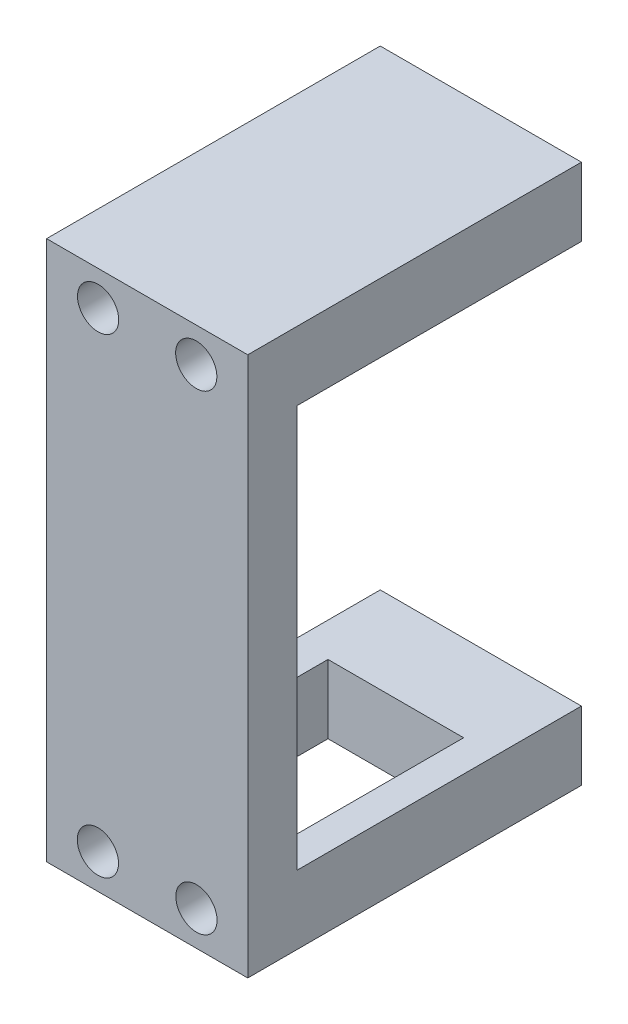
from build123d import *

# Parameters (mm, degrees)
BOSS_EXTRUDE1_DEPTH = 20.5
SKETCH3_W           = 13.820879987
SKETCH3_H           = 19.579579981
CUT_EXTRUDE1_DEPTH  = 7
SKETCH4_R           = 2.1
CUT_EXTRUDE2_DEPTH  = 5


with BuildPart() as part:
    # Sketch1 → Boss-Extrude1 (new body)
    with BuildSketch(Plane(origin=(0, 0, 0), x_dir=(0, 0, -1), z_dir=(1, 0, 0))):
        Polygon((-2.5, 27.5), (2.5, 27.5), (31.5, 27.5), (31.5, 20.5), (2.5, 20.5), (2.5, -20.5), (31.5, -20.5), (31.5, -27.5), (2.5, -27.5), (-2.5, -27.5), align=None)
    extrude(amount=BOSS_EXTRUDE1_DEPTH)

    # Sketch3 → Cut-Extrude1 (cut)
    with BuildSketch(Plane.XZ.offset(27.5)):
        with Locations((10.385498824, -12.910906187)):
            Rectangle(SKETCH3_W, SKETCH3_H)
    extrude(amount=-CUT_EXTRUDE1_DEPTH, mode=Mode.SUBTRACT)

    # Sketch4 → Cut-Extrude2 (cut)
    with BuildSketch(Plane(origin=(0, 0, -31.5), x_dir=(-1, 0, 0), z_dir=(0, 0, -1))):
        with Locations((-15.271378587, -23.970399076)):
            Circle(SKETCH4_R)
        with Locations(Location((-5.228621413, -23.970399076, 0), (0, 0, 180))):
            Circle(SKETCH4_R)
        with Locations((-5.25, 24)):
            Circle(SKETCH4_R)
        with Locations(Location((-15.25, 24, 0), (0, 0, 180))):
            Circle(SKETCH4_R)
    cut_extrude2 = extrude(amount=-CUT_EXTRUDE2_DEPTH, mode=Mode.SUBTRACT)

    # Mirror1: Cut-Extrude2 across plane
    add(cut_extrude2.mirror(Plane.XY.offset(-14.5)), mode=Mode.SUBTRACT)


solid = part.part
